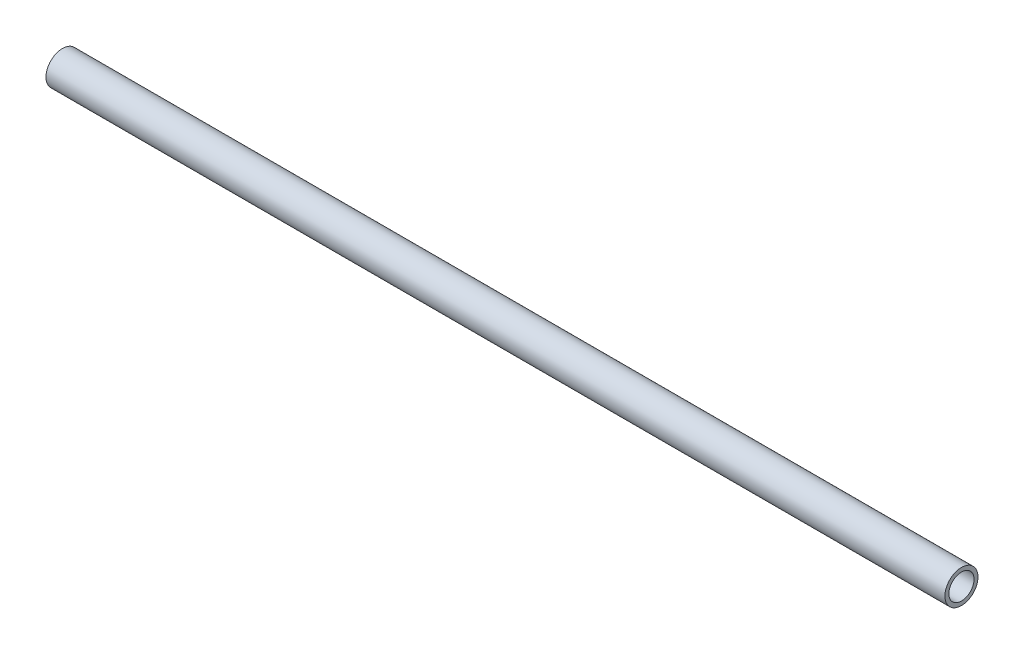
from build123d import *

# Parameters (mm, degrees)
SKETCH1_R           = 12.7
SKETCH1_R_2         = 9.652
BOSS_EXTRUDE1_DEPTH = 690


with BuildPart() as part:
    # Sketch1 → Boss-Extrude1 (new body)
    with BuildSketch(Plane(origin=(0, 0, 0), x_dir=(0, 0, -1), z_dir=(1, 0, 0))):
        Circle(SKETCH1_R)
        Circle(SKETCH1_R_2, mode=Mode.SUBTRACT)
    extrude(amount=BOSS_EXTRUDE1_DEPTH)


solid = part.part
